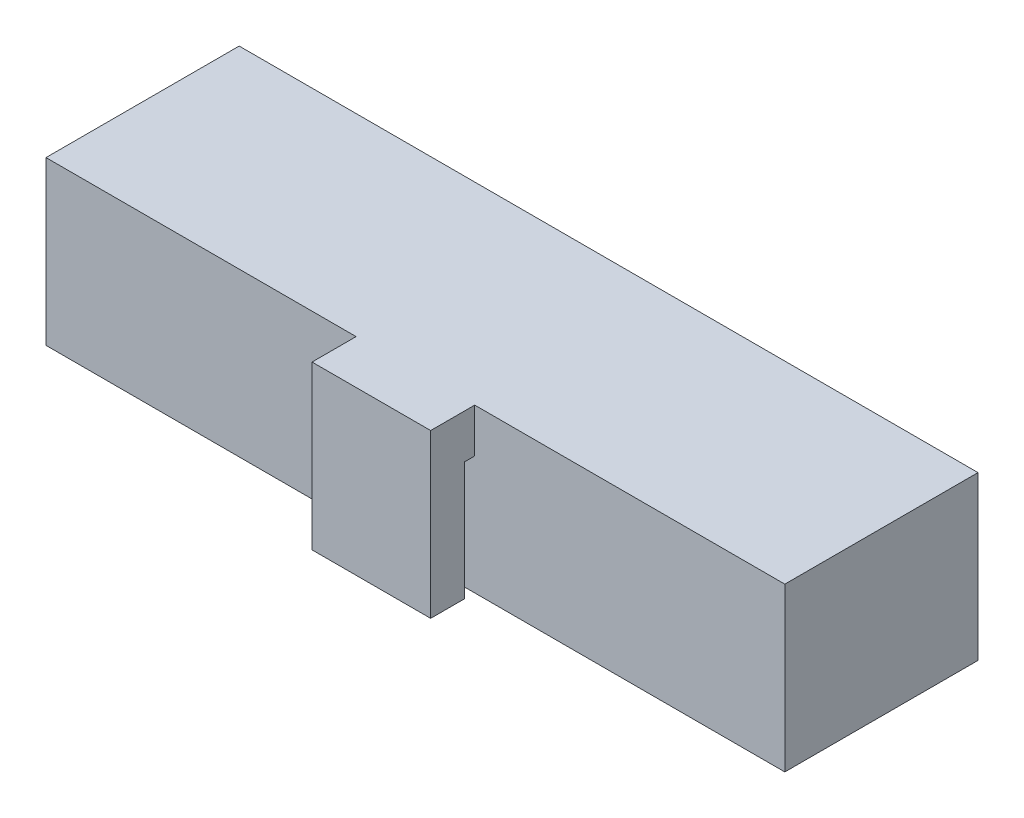
from build123d import *

# Parameters (mm, degrees)
ESQUISSE1_W             = 21.8
ESQUISSE1_H             = 4.8
BOSS_EXTRU_1_DEPTH      = 7
ESQUISSE2_W             = 9.15
ESQUISSE2_H             = 4.8
ENL_V_MAT_EXTRU_1_DEPTH = 1.3
ESQUISSE3_W             = 3.5
ESQUISSE3_H             = 0.3
ENL_V_MAT_EXTRU_2_DEPTH = 3.5


with BuildPart() as part:
    # Esquisse1 → Boss.-Extru.1 (new body)
    with BuildSketch(Plane.XY):
        Rectangle(ESQUISSE1_W, ESQUISSE1_H)
    extrude(amount=BOSS_EXTRU_1_DEPTH)

    # Esquisse2 → Enlèv. mat.-Extru.1 (cut)
    with BuildSketch(Plane.XY.offset(7)):
        with Locations((-6.325, 0)):
            Rectangle(ESQUISSE2_W, ESQUISSE2_H)
        with Locations((6.325, 0)):
            Rectangle(ESQUISSE2_W, ESQUISSE2_H)
    extrude(amount=-ENL_V_MAT_EXTRU_1_DEPTH, mode=Mode.SUBTRACT)

    # Esquisse3 → Enlèv. mat.-Extru.2 (cut)
    with BuildSketch(Plane.XZ.offset(2.4)):
        with Locations((0, 5.85)):
            Rectangle(ESQUISSE3_W, ESQUISSE3_H)
    extrude(amount=-ENL_V_MAT_EXTRU_2_DEPTH, mode=Mode.SUBTRACT)


solid = part.part
